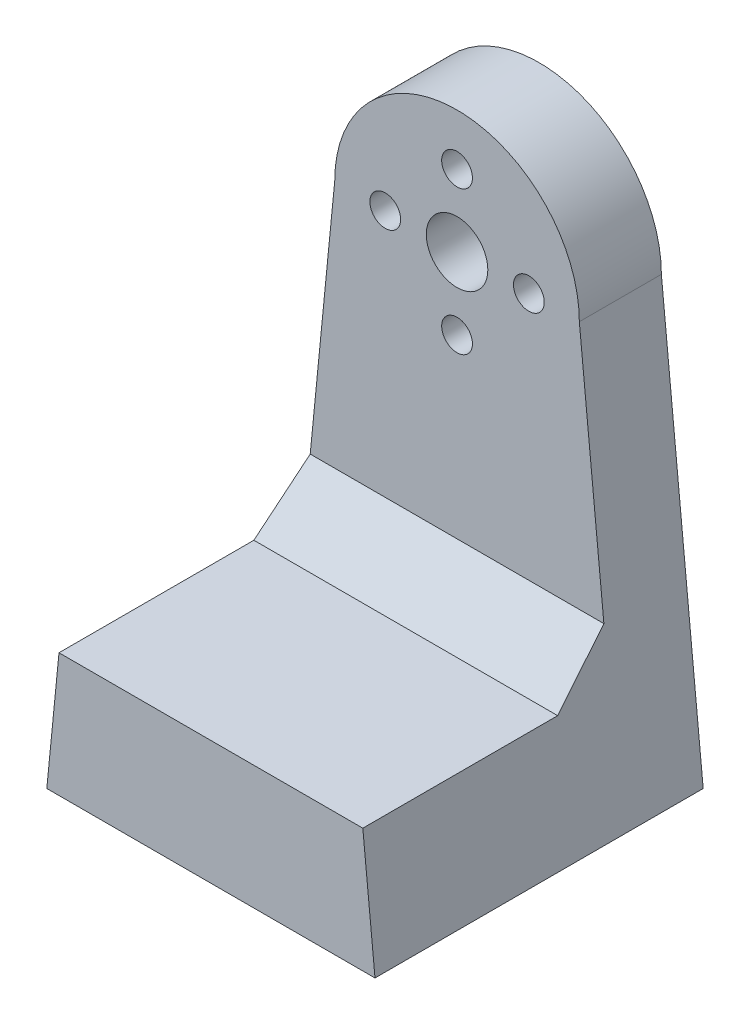
from build123d import *

# Parameters (mm, degrees)
CROQUIS1_W              = 32
CROQUIS1_H              = 32
SALIENTE_EXTRUIR1_DEPTH = 42
CORTAR_EXTRUIR1_DEPTH   = 42
CROQUIS3_W              = 8
CROQUIS3_H              = 0.624082803
CORTAR_EXTRUIR2_DEPTH   = 42
CORTAR_EXTRUIR3_DEPTH   = 55.698871322
CROQUIS7_R              = 11.922640385
SALIENTE_EXTRUIR3_DEPTH = 8
CROQUIS8_R              = 3
CROQUIS8_R_2            = 1.5
CORTAR_EXTRUIR5_DEPTH   = 61.603104214
CROQUIS9_R              = 2.05
CORTAR_EXTRUIR6_DEPTH   = 6


with BuildPart() as part:
    # Croquis1 → Saliente-Extruir1 (new body)
    with BuildSketch(Plane(origin=(0, 0, 0), x_dir=(1, 0, 0), z_dir=(0, 1, 0))):
        Rectangle(CROQUIS1_W, CROQUIS1_H)
    extrude(amount=SALIENTE_EXTRUIR1_DEPTH)

    # Croquis2 → Cortar-Extruir1 (cut)
    with BuildSketch(Plane(origin=(16, 0, 0), x_dir=(0, 0, -1), z_dir=(1, 0, 0))):
        Polygon((-16, 12.058), (3, 12.058), (8, 17.081917197), (8, 42), (-16, 42), align=None)
    extrude(amount=-CORTAR_EXTRUIR1_DEPTH, mode=Mode.SUBTRACT)

    # Croquis3 → Cortar-Extruir2 (cut)
    with BuildSketch(Plane(origin=(16, 0, 0), x_dir=(0, 0, -1), z_dir=(1, 0, 0))):
        with Locations((12, 41.687958599)):
            Rectangle(CROQUIS3_W, CROQUIS3_H)
    extrude(amount=-CORTAR_EXTRUIR2_DEPTH, mode=Mode.SUBTRACT)

    # Croquis6 → Cortar-Extruir3 (cut, through all)
    with BuildSketch(Plane.XY.offset(16)):
        Polygon((-16, 0), (-11.922640385, 41.375917197), (-16, 41.375917197), align=None)
        Polygon((16, 0), (11.922640385, 41.375917197), (16, 41.375917197), align=None)
    extrude(amount=-CORTAR_EXTRUIR3_DEPTH, mode=Mode.SUBTRACT)

    # Croquis7 → Saliente-Extruir3 (add)
    with BuildSketch(Plane(origin=(0, 0, -16), x_dir=(-1, 0, 0), z_dir=(0, 0, -1))):
        with Locations((0, 41.375917197)):
            Circle(CROQUIS7_R)
    extrude(amount=-SALIENTE_EXTRUIR3_DEPTH)

    # Croquis8 → Cortar-Extruir5 (cut, through all)
    with BuildSketch(Plane.XY.offset(-8)):
        with Locations((0, 41.298557582)):
            Circle(CROQUIS8_R)
        with Locations((1.182e-06, 48.298557582)):
            Circle(CROQUIS8_R_2)
        with Locations((7, 41.2985564)):
            Circle(CROQUIS8_R_2)
        with Locations((-1.182e-06, 34.298557582)):
            Circle(CROQUIS8_R_2)
        with Locations((-7, 41.298558764)):
            Circle(CROQUIS8_R_2)
    extrude(amount=-CORTAR_EXTRUIR5_DEPTH, mode=Mode.SUBTRACT)

    # Croquis9 → Cortar-Extruir6 (cut)
    with BuildSketch(Plane.XZ):
        with Locations(Location((-8, 7.5, 0), (0, 0, 270))):
            Circle(CROQUIS9_R)
        with Locations(Location((8, 7.5, 0), (0, 0, 270))):
            Circle(CROQUIS9_R)
    extrude(amount=-CORTAR_EXTRUIR6_DEPTH, mode=Mode.SUBTRACT)


solid = part.part
